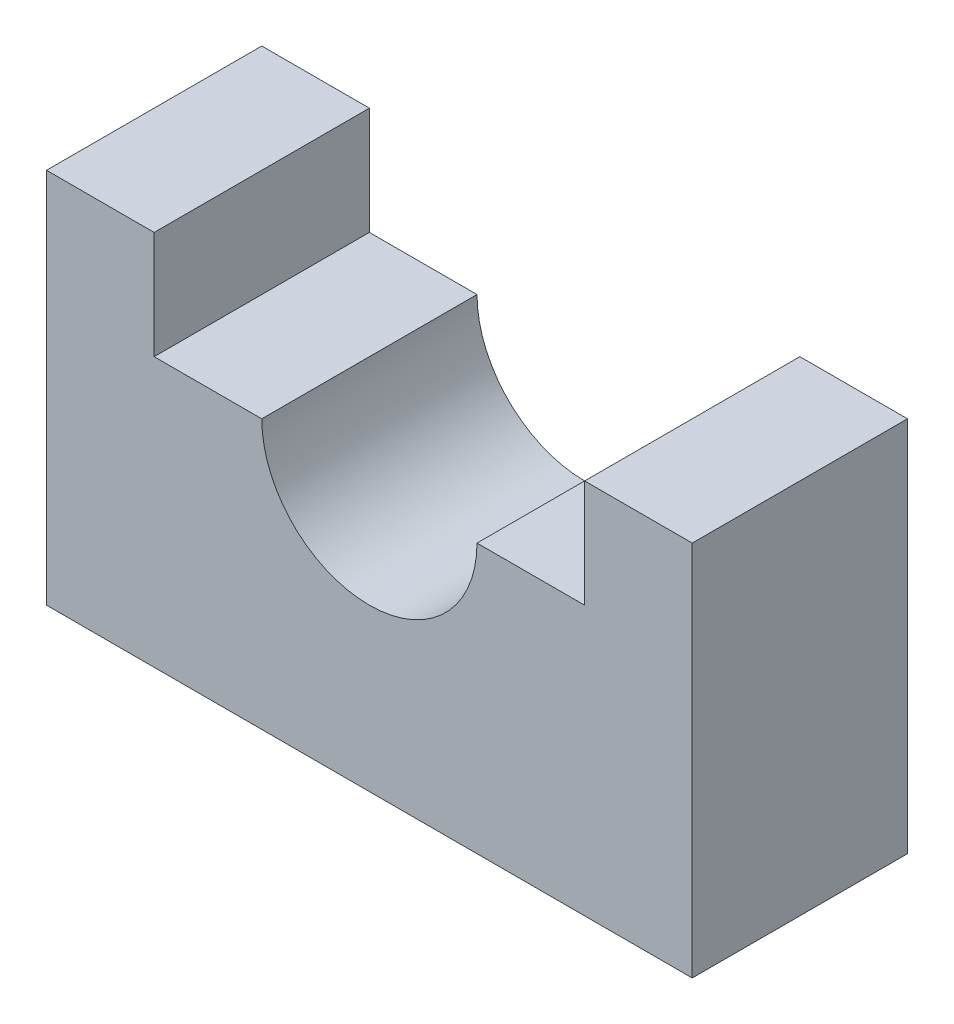
from build123d import *

# Parameters (mm, degrees)
BOSS_EXTRUDE2_DEPTH = 20


with BuildPart() as part:
    # Sketch1 → Boss-Extrude2 (new body)
    with BuildSketch(Plane.XY):
        with BuildLine():
            Line((-30, 0), (30, 0))
            Line((30, 0), (30, 35))
            Line((30, 35), (20, 35))
            Line((20, 35), (20, 25))
            Line((20, 25), (10, 25))
            ThreePointArc((10, 25), (0, 15), (-10, 25))
            Line((-10, 25), (-20, 25))
            Line((-20, 25), (-20, 35))
            Line((-20, 35), (-30, 35))
            Line((-30, 35), (-30, 0))
        make_face()
    extrude(amount=BOSS_EXTRUDE2_DEPTH)


solid = part.part
